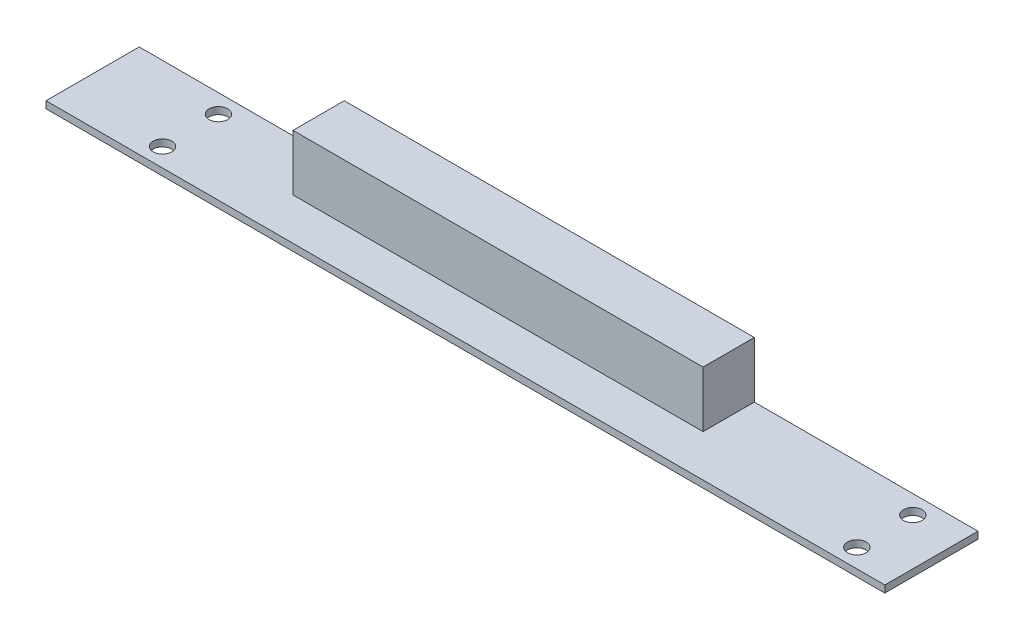
from build123d import *

# Parameters (mm, degrees)
SKETCH1_W           = 180
SKETCH1_H           = 20
SKETCH1_R           = 2
BOSS_EXTRUDE1_DEPTH = 1.5
SKETCH2_W           = 88
SKETCH2_H           = 11
BOSS_EXTRUDE2_DEPTH = 12


with BuildPart() as part:
    # Sketch1 → Boss-Extrude1 (new body)
    with BuildSketch(Plane(origin=(0, 0, 0), x_dir=(1, 0, 0), z_dir=(0, 1, 0))):
        Rectangle(SKETCH1_W, SKETCH1_H)
        with Locations(Location((-69, 6, 0), (0, 0, 270))):
            Circle(SKETCH1_R, mode=Mode.SUBTRACT)
        with Locations(Location((-69, -6, 0), (0, 0, 270))):
            Circle(SKETCH1_R, mode=Mode.SUBTRACT)
        with Locations(Location((80, 6, 0), (0, 0, 270))):
            Circle(SKETCH1_R, mode=Mode.SUBTRACT)
        with Locations(Location((80, -6, 0), (0, 0, 270))):
            Circle(SKETCH1_R, mode=Mode.SUBTRACT)
    extrude(amount=BOSS_EXTRUDE1_DEPTH)

    # Sketch2 → Boss-Extrude2 (add)
    with BuildSketch(Plane(origin=(0, 1.5, 0), x_dir=(-1, 0, 0), z_dir=(0, 1, 0))):
        with Locations((2, -4.5)):
            Rectangle(SKETCH2_W, SKETCH2_H)
    extrude(amount=BOSS_EXTRUDE2_DEPTH)


solid = part.part
